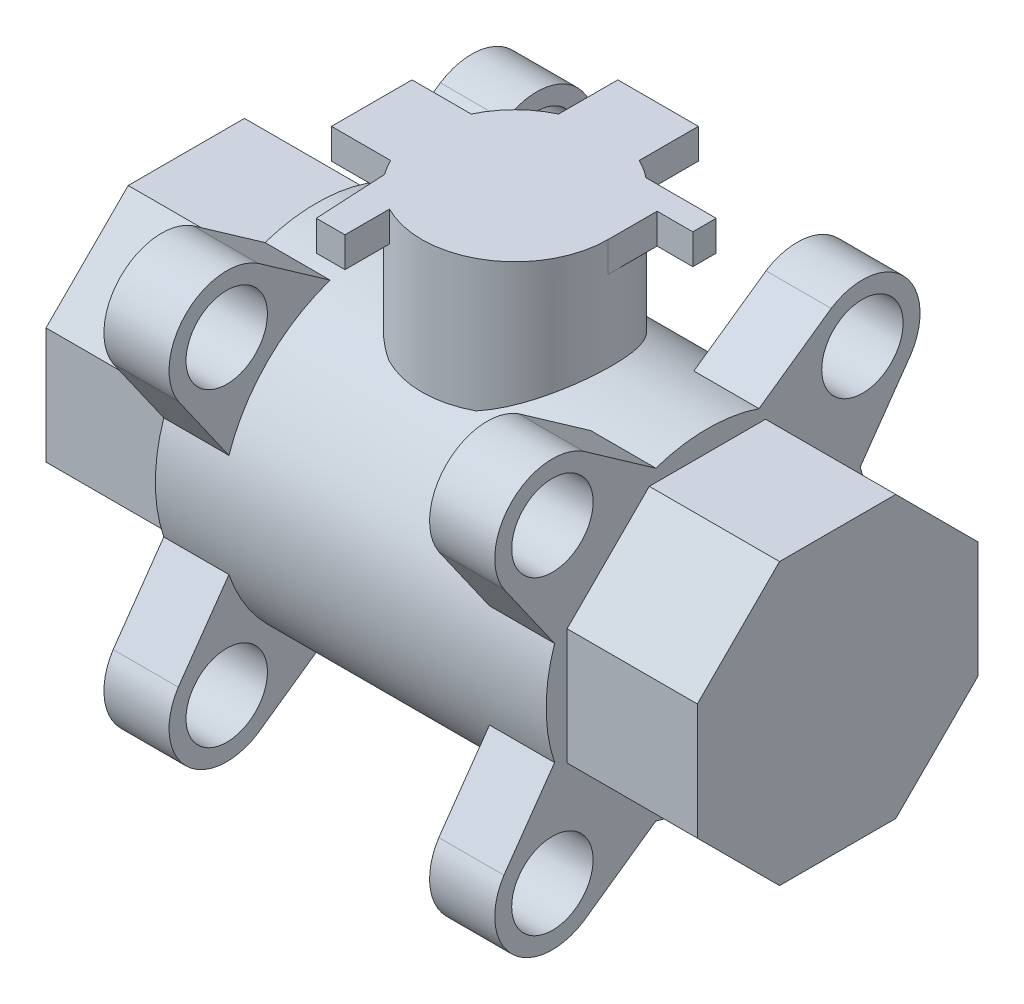
from build123d import *

# Parameters (mm, degrees)
SKETCH1_R            = 3.96875
BOSS_EXTRUDE2_DEPTH  = 6.35
BOSS_EXTRUDE3_DEPTH  = 12.7
SKETCH3_R            = 15.7226
BOSS_EXTRUDE4_DEPTH  = 25.4
SKETCH4_R            = 3.96875
BOSS_EXTRUDE5_DEPTH  = 6.35
BOSS_EXTRUDE6_DEPTH  = 12.7
SKETCH6_R            = 9.0805
BOSS_EXTRUDE8_DEPTH  = 12.8778
SKETCH8_W            = 7.8486
SKETCH8_H            = 8.0772
SKETCH8_W_2          = 8.0772
SKETCH8_H_2          = 7.8486
BOSS_EXTRUDE9_DEPTH  = 2.9464
BOSS_EXTRUDE10_START = -2.9464
BOSS_EXTRUDE10_DEPTH = 2.9464


with BuildPart() as part:
    # Sketch1 → Boss-Extrude2 (new body)
    with BuildSketch(Plane(origin=(0, 0, 0), x_dir=(0, 0, -1), z_dir=(1, 0, 0))):
        with BuildLine():
            Line((-19.834703053, 12.065523939), (-14.896576623, 5.029130709))
            ThreePointArc((-14.896576623, 5.029130709), (-15.7226, 0), (-14.896576623, -5.029130709))
            Line((-14.896576623, -5.029130709), (-19.834703053, -12.065523939))
            ThreePointArc((-19.834703053, -12.065523939), (-19.086763334, -19.086763334), (-12.065523939, -19.834703053))
            Line((-12.065523939, -19.834703053), (-5.029130709, -14.896576623))
            ThreePointArc((-5.029130709, -14.896576623), (0, -15.7226), (5.029130709, -14.896576623))
            Line((5.029130709, -14.896576623), (12.065523939, -19.834703053))
            ThreePointArc((12.065523939, -19.834703053), (19.086763334, -19.086763334), (19.834703053, -12.065523939))
            Line((19.834703053, -12.065523939), (14.896576623, -5.029130709))
            ThreePointArc((14.896576623, -5.029130709), (15.7226, 0), (14.896576623, 5.029130709))
            Line((14.896576623, 5.029130709), (19.834703053, 12.065523939))
            ThreePointArc((19.834703053, 12.065523939), (19.086763334, 19.086763334), (12.065523939, 19.834703053))
            Line((12.065523939, 19.834703053), (5.029130709, 14.896576623))
            ThreePointArc((5.029130709, 14.896576623), (0, 15.7226), (-5.029130709, 14.896576623))
            Line((-5.029130709, 14.896576623), (-12.065523939, 19.834703053))
            ThreePointArc((-12.065523939, 19.834703053), (-19.086763334, 19.086763334), (-19.834703053, 12.065523939))
        make_face()
        with Locations((-15.113, 15.113)):
            Circle(SKETCH1_R, mode=Mode.SUBTRACT)
        with Locations(Location((15.113, 15.113, 0), (0, 0, 180))):
            Circle(SKETCH1_R, mode=Mode.SUBTRACT)
        with Locations((15.113, -15.113)):
            Circle(SKETCH1_R, mode=Mode.SUBTRACT)
        with Locations(Location((-15.113, -15.113, 0), (0, 0, 180))):
            Circle(SKETCH1_R, mode=Mode.SUBTRACT)
    extrude(amount=BOSS_EXTRUDE2_DEPTH)

    # Sketch2 → Boss-Extrude3 (add)
    with BuildSketch(Plane.ZY):
        Polygon((13.680992893, 5.666852803), (13.680992893, -5.666852803), (5.666852803, -13.680992893), (-5.666852803, -13.680992893), (-13.680992893, -5.666852803), (-13.680992893, 5.666852803), (-5.666852803, 13.680992893), (5.666852803, 13.680992893), align=None)
    extrude(amount=BOSS_EXTRUDE3_DEPTH)

    # Sketch3 → Boss-Extrude4 (add)
    with BuildSketch(Plane(origin=(6.35, 0, 0), x_dir=(0, 0, -1), z_dir=(1, 0, 0))):
        with Locations(Location((0, 0, 0), (0, 0, 161.345157372))):
            Circle(SKETCH3_R)
    extrude(amount=BOSS_EXTRUDE4_DEPTH)

    # Sketch4 → Boss-Extrude5 (add)
    with BuildSketch(Plane(origin=(31.75, 0, 0), x_dir=(0, 0, -1), z_dir=(1, 0, 0))):
        with BuildLine():
            Line((-19.834703053, 12.065523939), (-14.896576623, 5.029130709))
            ThreePointArc((-14.896576623, 5.029130709), (-15.7226, 0), (-14.896576623, -5.029130709))
            Line((-14.896576623, -5.029130709), (-19.834703053, -12.065523939))
            ThreePointArc((-19.834703053, -12.065523939), (-19.086763334, -19.086763334), (-12.065523939, -19.834703053))
            Line((-12.065523939, -19.834703053), (-5.029130709, -14.896576623))
            ThreePointArc((-5.029130709, -14.896576623), (0, -15.7226), (5.029130709, -14.896576623))
            Line((5.029130709, -14.896576623), (12.065523939, -19.834703053))
            ThreePointArc((12.065523939, -19.834703053), (19.086763334, -19.086763334), (19.834703053, -12.065523939))
            Line((19.834703053, -12.065523939), (14.896576623, -5.029130709))
            ThreePointArc((14.896576623, -5.029130709), (15.7226, 0), (14.896576623, 5.029130709))
            Line((14.896576623, 5.029130709), (19.834703053, 12.065523939))
            ThreePointArc((19.834703053, 12.065523939), (19.086763334, 19.086763334), (12.065523939, 19.834703053))
            Line((12.065523939, 19.834703053), (5.029130709, 14.896576623))
            ThreePointArc((5.029130709, 14.896576623), (0, 15.7226), (-5.029130709, 14.896576623))
            Line((-5.029130709, 14.896576623), (-12.065523939, 19.834703053))
            ThreePointArc((-12.065523939, 19.834703053), (-19.086763334, 19.086763334), (-19.834703053, 12.065523939))
        make_face()
        with Locations((-15.113, 15.113)):
            Circle(SKETCH4_R, mode=Mode.SUBTRACT)
        with Locations(Location((15.113, 15.113, 0), (0, 0, 180))):
            Circle(SKETCH4_R, mode=Mode.SUBTRACT)
        with Locations((15.113, -15.113)):
            Circle(SKETCH4_R, mode=Mode.SUBTRACT)
        with Locations(Location((-15.113, -15.113, 0), (0, 0, 180))):
            Circle(SKETCH4_R, mode=Mode.SUBTRACT)
    extrude(amount=BOSS_EXTRUDE5_DEPTH)

    # Sketch5 → Boss-Extrude6 (add)
    with BuildSketch(Plane(origin=(38.1, 0, 0), x_dir=(0, 0, -1), z_dir=(1, 0, 0))):
        Polygon((13.680992893, 5.666852803), (13.680992893, -5.666852803), (5.666852803, -13.680992893), (-5.666852803, -13.680992893), (-13.680992893, -5.666852803), (-13.680992893, 5.666852803), (-5.666852803, 13.680992893), (5.666852803, 13.680992893), align=None)
    extrude(amount=BOSS_EXTRUDE6_DEPTH)

    # Sketch6 → Boss-Extrude8 (add)
    with BuildSketch(Plane(origin=(0, 13.680992893, 0), x_dir=(1, 0, 0), z_dir=(0, 1, 0))):
        with Locations(Location((19.05, 0.284018035, 0), (0, 0, 55.282753466))):
            Circle(SKETCH6_R)
    extrude(amount=BOSS_EXTRUDE8_DEPTH)

    # Sketch8 → Boss-Extrude9 (add)
    with BuildSketch(Plane(origin=(0, 26.558792893, 0), x_dir=(1, 0, 0), z_dir=(0, 1, 0))):
        with Locations((19.05, 10.202718035)):
            Rectangle(SKETCH8_W, SKETCH8_H)
        with Locations((9.1313, 0.284018035)):
            Rectangle(SKETCH8_W_2, SKETCH8_H_2)
    extrude(amount=-BOSS_EXTRUDE9_DEPTH)

    # Sketch10 → Boss-Extrude10 (add)
    with BuildSketch(Plane(origin=(0, 26.558792893, 0), x_dir=(1, 0, 0), z_dir=(0, 1, 0)).offset(BOSS_EXTRUDE10_START)):
        with BuildLine():
            Line((24.7523, 7.350789218), (31.6103, 7.350789218))
            Line((31.6103, 7.350789218), (31.6103, 5.064789218))
            Line((31.6103, 5.064789218), (28.1305, 5.064789218))
            Line((28.1305, 5.064789218), (28.1305, 0.284018035))
            ThreePointArc((28.1305, 0.284018035), (23.784459378, -7.464554392), (14.90647607, -7.795999892))
            Line((14.90647607, -7.795999892), (14.90647607, -12.140453608))
            Line((14.90647607, -12.140453608), (12.11247607, -12.140453608))
            Line((12.11247607, -12.140453608), (11.743935589, -5.108282316))
            ThreePointArc((11.743935589, -5.108282316), (12.769066077, 6.841864427), (24.7523, 7.350789218))
        make_face()
    extrude(amount=BOSS_EXTRUDE10_DEPTH)


solid = part.part
